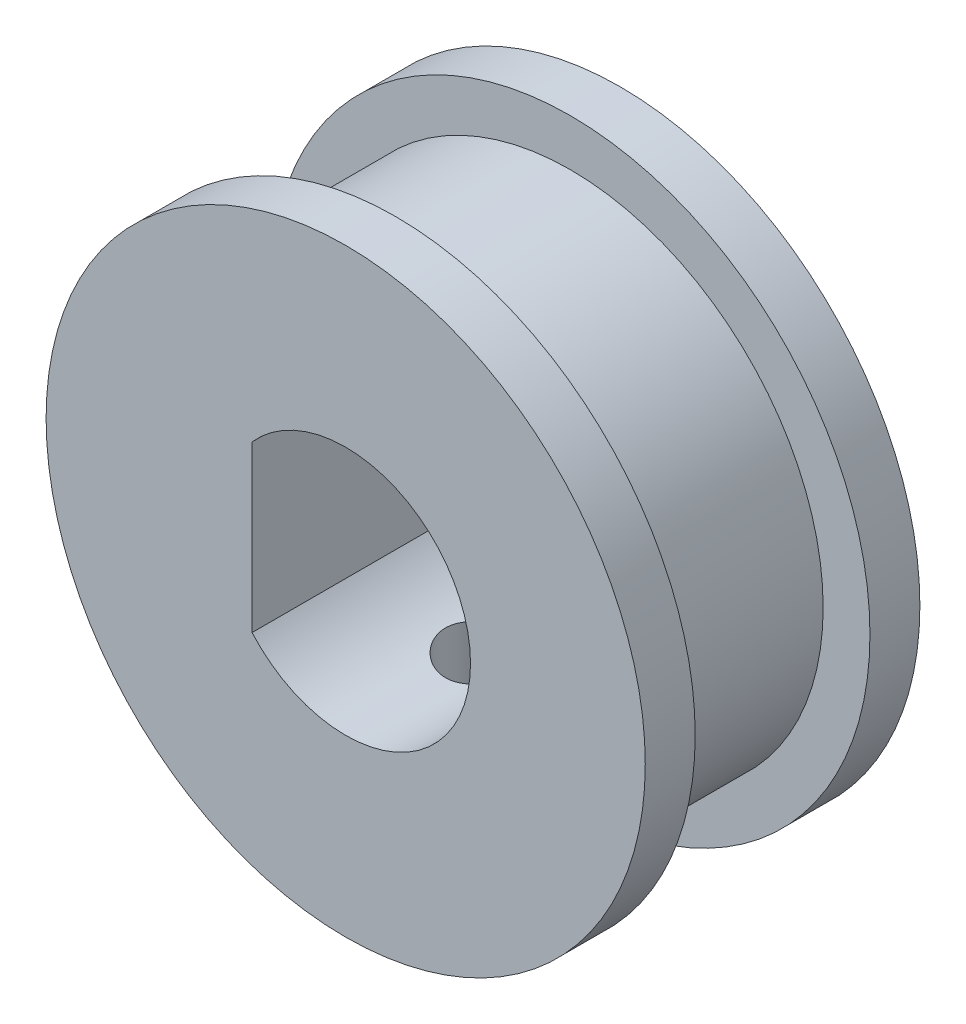
from build123d import *

# Parameters (mm, degrees)
SKETCH_1_R          = 10.125
EXTRUDE_1_DEPTH     = 3.5
SKETCH_2_R          = 12
EXTRUDE_2_DEPTH     = 2
CUT_EXTRUDE_1_DEPTH = 21.223748416
SKETCH_4_R          = 1.5
CUT_EXTRUDE_2_DEPTH = 18.839562775


with BuildPart() as part:
    # 草图1 → 凸台-拉伸1 (new, symmetric)
    with BuildSketch(Plane.XY):
        Circle(SKETCH_1_R)
    extrude(amount=EXTRUDE_1_DEPTH, both=True)

    # 草图2 → 凸台-拉伸2 (add)
    with BuildSketch(Plane.XY.offset(3.5)):
        Circle(SKETCH_2_R)
    extrude_2 = extrude(amount=EXTRUDE_2_DEPTH)

    # 镜向1: 凸台-拉伸2 across plane
    add(extrude_2.mirror(Plane.XY))

    # 草图3 → 切除-拉伸1 (cut, through all)
    with BuildSketch(Plane.XY.offset(5.5)):
        with BuildLine():
            Line((-3.75, 3.307189139), (-3.75, -3.307189139))
            ThreePointArc((-3.75, -3.307189139), (5, 0), (-3.75, 3.307189139))
        make_face()
    extrude(amount=-CUT_EXTRUDE_1_DEPTH, mode=Mode.SUBTRACT)

    # 草图4 → 切除-拉伸2 (cut, through all)
    with BuildSketch(Plane(origin=(0, 0, 0), x_dir=(1, 0, 0), z_dir=(0, 1, 0))):
        with Locations(Location((0, 0, 0), (0, 0, 270))):
            Circle(SKETCH_4_R)
    extrude(amount=-CUT_EXTRUDE_2_DEPTH, mode=Mode.SUBTRACT)


solid = part.part
